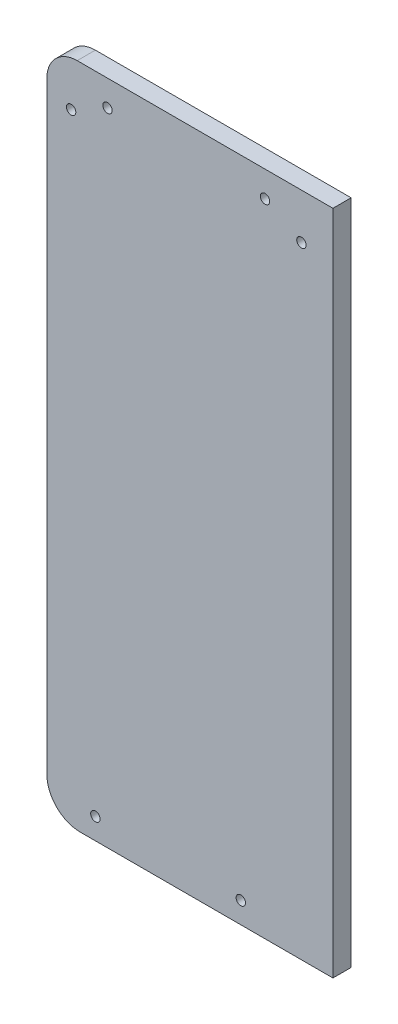
from build123d import *

# Parameters (mm, degrees)
DODANIE_WYCI_GNI_CIE1_DEPTH = 6
SZKIC4_R                    = 1.55
WYTNIJ_WYCI_GNI_CIE1_DEPTH  = 6
SZKIC7_R                    = 1.55
WYTNIJ_WYCI_GNI_CIE3_DEPTH  = 6


with BuildPart() as part:
    # Szkic2 → Dodanie-wyciągnięcie1 (new body)
    with BuildSketch(Plane.XY):
        with BuildLine():
            Line((-10.6, -166.603962956), (-10.6, -386.603962956))
            Line((-10.6, -386.603962956), (-94, -386.603962956))
            ThreePointArc((-94, -386.603962956), (-101.778174593, -383.382137549), (-105, -375.603962956))
            Line((-105, -375.603962956), (-105, -176.603962956))
            ThreePointArc((-105, -176.603962956), (-102.071067812, -169.532895144), (-95, -166.603962956))
            Line((-95, -166.603962956), (-10.6, -166.603962956))
        make_face()
    extrude(amount=DODANIE_WYCI_GNI_CIE1_DEPTH)

    # Szkic4 → Wytnij-wyciągnięcie1 (cut)
    with BuildSketch(Plane.XY.offset(6)):
        with Locations((-41, -379.603962956)):
            Circle(SZKIC4_R)
        with Locations((-89, -379.603962956)):
            Circle(SZKIC4_R)
    extrude(amount=-WYTNIJ_WYCI_GNI_CIE1_DEPTH, mode=Mode.SUBTRACT)

    # Szkic7 → Wytnij-wyciągnięcie3 (cut)
    with BuildSketch(Plane.XY.offset(6)):
        with Locations((-21, -181.603962956)):
            Circle(SZKIC7_R)
        with Locations((-97, -181.603962956)):
            Circle(SZKIC7_R)
        with Locations((-85, -175.103962956)):
            Circle(SZKIC7_R)
        with Locations((-33, -175.103962956)):
            Circle(SZKIC7_R)
    extrude(amount=-WYTNIJ_WYCI_GNI_CIE3_DEPTH, mode=Mode.SUBTRACT)


solid = part.part
